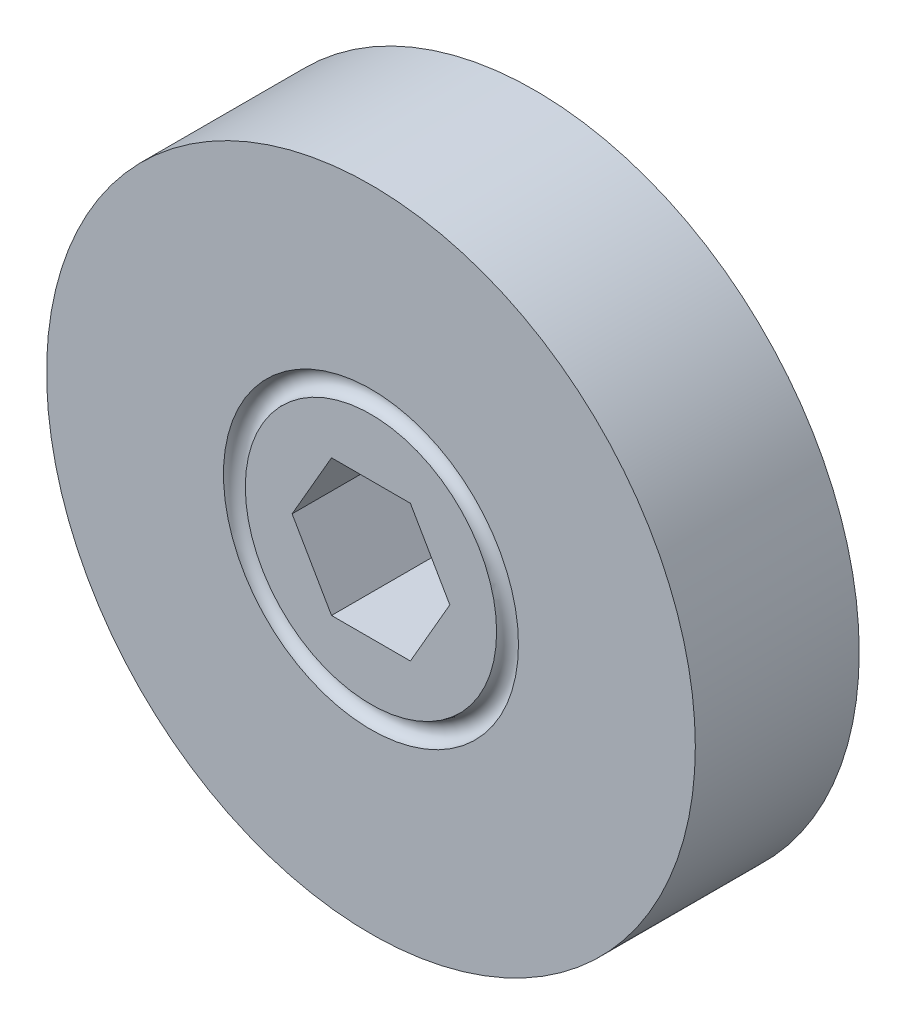
from build123d import *

# Parameters (mm, degrees)
CUT_EXTRUDE1_REACH = 47.297


with BuildPart() as part:
    # Sketch1 → Revolve1 (revolve)
    with BuildSketch(Plane(origin=(0, 0, 0), x_dir=(0, 0, -1), z_dir=(1, 0, 0)), mode=Mode.PRIVATE) as revolve1_sk:
        with BuildLine():
            Line((-7.62, 30.1625), (7.62, 30.1625))
            Line((7.62, 30.1625), (7.62, 13.716))
            ThreePointArc((7.62, 13.716), (6.604, 12.7), (7.62, 11.684))
            Line((7.62, 11.684), (7.62, 0))
            Line((7.62, 0), (-7.62, 0))
            Line((-7.62, 0), (-7.62, 11.684))
            ThreePointArc((-7.62, 11.684), (-6.604, 12.7), (-7.62, 13.716))
            Line((-7.62, 13.716), (-7.62, 30.1625))
        make_face()
    revolve(revolve1_sk.sketch.rotate(Axis((0, 0, 7.62), (0, 0, -1)), 90), axis=Axis((0, 0, 7.62), (0, 0, -1)))

    # Sketch2 → Cut-Extrude1 (cut, up to next)
    with BuildSketch(Plane.XY.offset(7.62), mode=Mode.PRIVATE) as cut_extrude1_sk1:
        Polygon((-3.666174209, 6.35), (-7.332348419, 0), (-3.666174209, -6.35), (3.666174209, -6.35), (7.332348419, 0), (3.666174209, 6.35), align=None)
    cut_extrude1_tool1 = extrude(cut_extrude1_sk1.sketch, amount=-CUT_EXTRUDE1_REACH, mode=Mode.PRIVATE) & part.part
    add(cut_extrude1_tool1.solids().sort_by_distance((0, 0, 7.62))[0], mode=Mode.SUBTRACT)


solid = part.part
